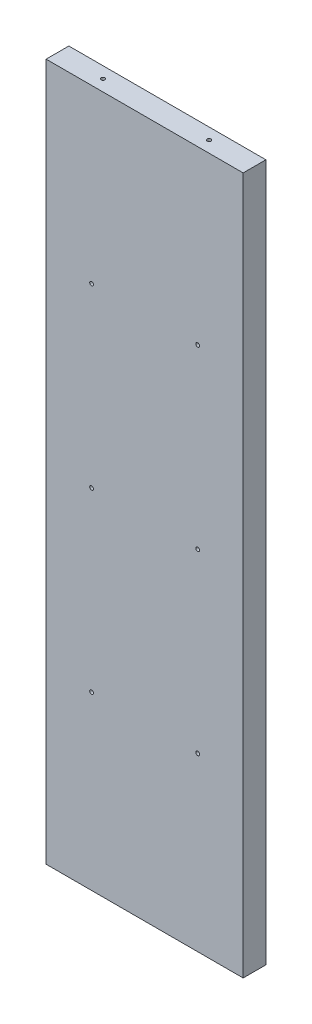
from build123d import *

# Parameters (mm, degrees)
ESQUISSE1_W             = 390
ESQUISSE1_H             = 45
BOSS_EXTRU_1_DEPTH      = 1380
ESQUISSE2_R             = 3.75
ENL_V_MAT_EXTRU_1_DEPTH = 20
ESQUISSE3_R             = 3.75
ENL_V_MAT_EXTRU_2_DEPTH = 20
ENL_V_START             = -20
ESQUISSE4_R             = 3.75
ENL_V_MAT_EXTRU_3_DEPTH = 20


with BuildPart() as part:
    # Esquisse1 → Boss.-Extru.1 (new body)
    with BuildSketch(Plane(origin=(0, 0, 0), x_dir=(1, 0, 0), z_dir=(0, 1, 0))):
        Rectangle(ESQUISSE1_W, ESQUISSE1_H)
    extrude(amount=BOSS_EXTRU_1_DEPTH)

    # Esquisse2 → Enlèv. mat.-Extru.1 (cut)
    with BuildSketch(Plane.XY.offset(22.5)):
        with Locations((-105, 1040)):
            Circle(ESQUISSE2_R)
        with Locations(Location((105, 1040, 0), (0, 0, 180))):
            Circle(ESQUISSE2_R)
        with Locations((-105, 690)):
            Circle(ESQUISSE2_R)
        with Locations((-105, 340)):
            Circle(ESQUISSE2_R)
        with Locations(Location((105, 340, 0), (0, 0, 180))):
            Circle(ESQUISSE2_R)
        with Locations(Location((105, 690, 0), (0, 0, 180))):
            Circle(ESQUISSE2_R)
    extrude(amount=-ENL_V_MAT_EXTRU_1_DEPTH, mode=Mode.SUBTRACT)

    # Esquisse3 → Enlèv. mat.-Extru.2 (cut)
    with BuildSketch(Plane(origin=(0, 1380, 0), x_dir=(1, 0, 0), z_dir=(0, 1, 0))):
        with Locations(Location((-105, 0, 0), (0, 0, 270))):
            Circle(ESQUISSE3_R)
        with Locations(Location((105, 0, 0), (0, 0, 270))):
            Circle(ESQUISSE3_R)
    extrude(amount=-ENL_V_MAT_EXTRU_2_DEPTH, mode=Mode.SUBTRACT)

    # Esquisse4 → Enlèv. mat.-Extru.3 (cut)
    with BuildSketch(Plane.XZ.offset(ENL_V_START)):
        with Locations(Location((-105, 0, 0), (0, 0, 90))):
            Circle(ESQUISSE4_R)
        with Locations(Location((105, 0, 0), (0, 0, 90))):
            Circle(ESQUISSE4_R)
    extrude(amount=ENL_V_MAT_EXTRU_3_DEPTH, mode=Mode.SUBTRACT)


solid = part.part
